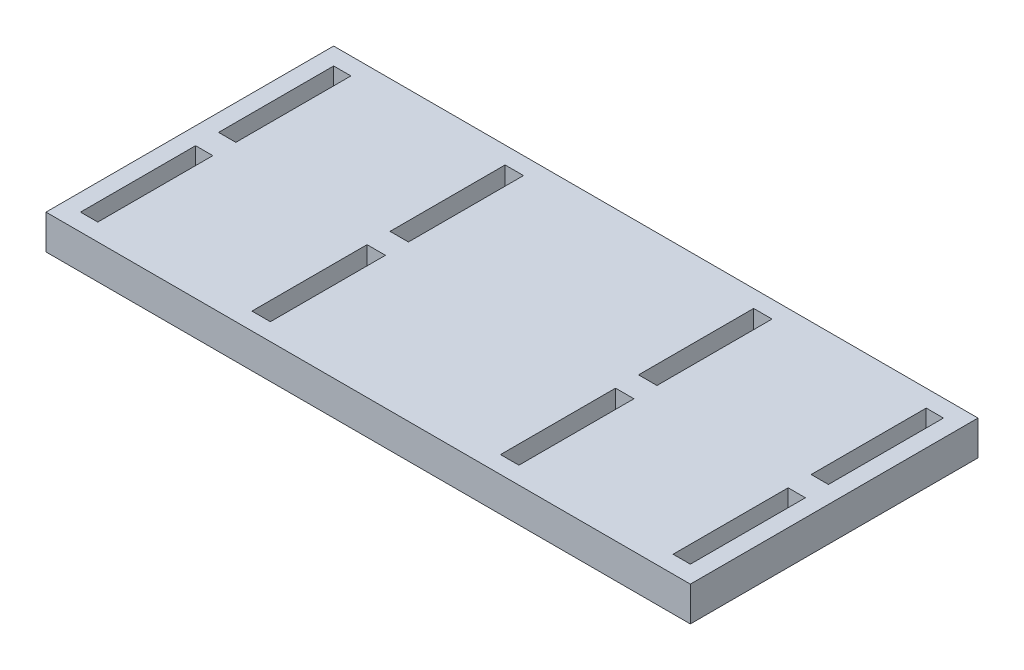
from build123d import *

# Parameters (mm, degrees)
SKETCH_1_W      = 112
SKETCH_1_H      = 50
SKETCH_1_W_2    = 3
SKETCH_1_H_2    = 20
SKETCH_1_W_3    = 3.2
EXTRUDE_1_DEPTH = 6


with BuildPart() as part:
    # 草图1 → 凸台-拉伸1 (new body)
    with BuildSketch(Plane(origin=(0, 0, 0), x_dir=(1, 0, 0), z_dir=(0, 1, 0))):
        with Locations((56, -25)):
            Rectangle(SKETCH_1_W, SKETCH_1_H)
        with Locations((4.5, -13)):
            Rectangle(SKETCH_1_W_2, SKETCH_1_H_2, mode=Mode.SUBTRACT)
        with Locations((4.5, -37)):
            Rectangle(SKETCH_1_W_2, SKETCH_1_H_2, mode=Mode.SUBTRACT)
        with Locations((107.5, -13)):
            Rectangle(SKETCH_1_W_2, SKETCH_1_H_2, mode=Mode.SUBTRACT)
        with Locations((107.5, -37)):
            Rectangle(SKETCH_1_W_2, SKETCH_1_H_2, mode=Mode.SUBTRACT)
        with Locations((34.4, -37)):
            Rectangle(SKETCH_1_W_3, SKETCH_1_H_2, mode=Mode.SUBTRACT)
        with Locations((34.4, -13)):
            Rectangle(SKETCH_1_W_3, SKETCH_1_H_2, mode=Mode.SUBTRACT)
        with Locations((77.6, -37)):
            Rectangle(SKETCH_1_W_3, SKETCH_1_H_2, mode=Mode.SUBTRACT)
        with Locations((77.6, -13)):
            Rectangle(SKETCH_1_W_3, SKETCH_1_H_2, mode=Mode.SUBTRACT)
    extrude(amount=EXTRUDE_1_DEPTH)


solid = part.part
